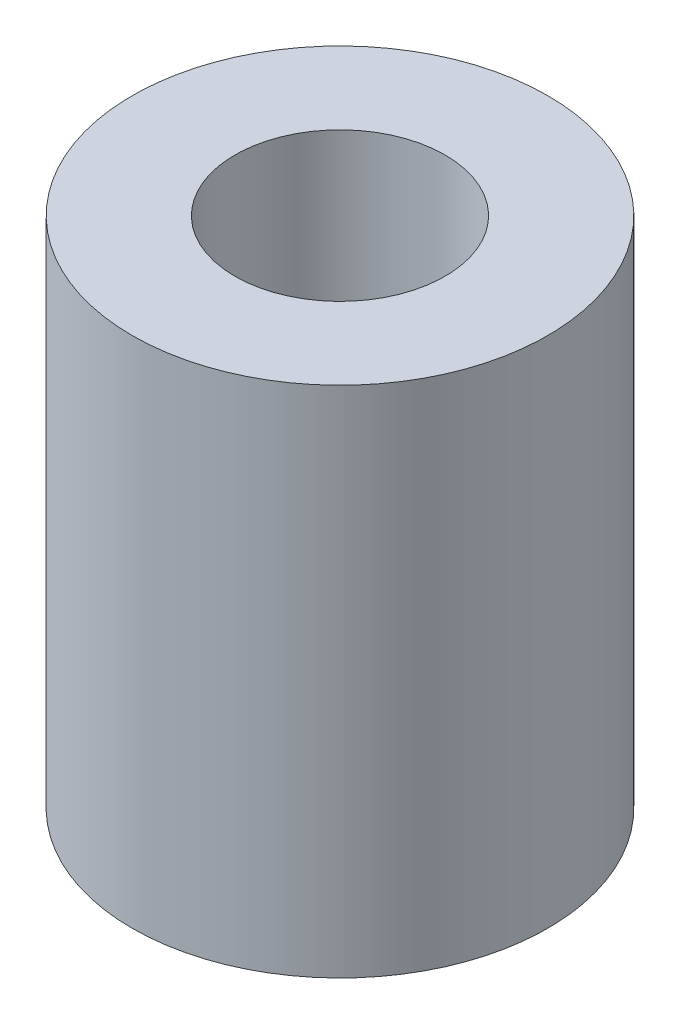
from build123d import *

# Parameters (mm, degrees)
F_5MM_R             = 5.14
F_5MM_R_2           = 2.6
BOSS_EXTRUDE1_DEPTH = 12.7


with BuildPart() as part:
    # 5mm → Boss-Extrude1 (new body)
    with BuildSketch(Plane(origin=(0, 0, 0), x_dir=(1, 0, 0), z_dir=(0, 1, 0))):
        with Locations(Location((0, 0, 0), (0, 0, 270))):
            Circle(F_5MM_R)
        with Locations(Location((0, 0, 0), (0, 0, 270))):
            Circle(F_5MM_R_2, mode=Mode.SUBTRACT)
    extrude(amount=BOSS_EXTRUDE1_DEPTH)


solid = part.part
